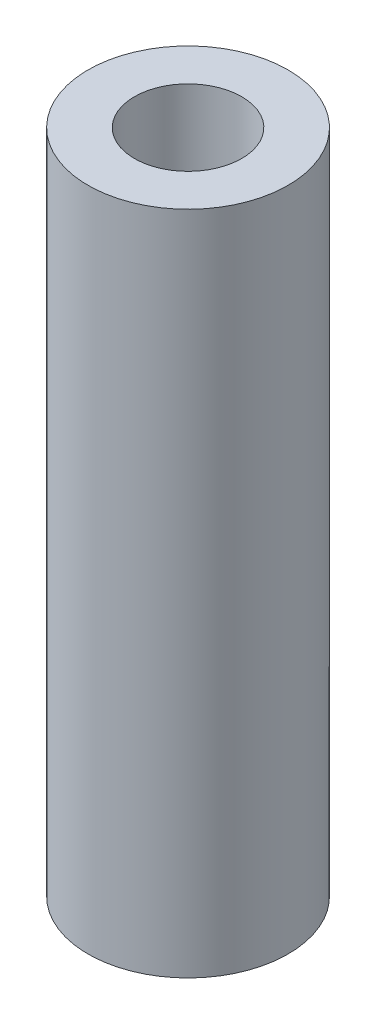
from build123d import *

# Parameters (mm, degrees)
SKETCH1_R           = 4.7625
SKETCH1_R_2         = 2.5527
BOSS_EXTRUDE1_DEPTH = 31.6992


with BuildPart() as part:
    # Sketch1 → Boss-Extrude1 (new body)
    with BuildSketch(Plane(origin=(0, 0, 0), x_dir=(1, 0, 0), z_dir=(0, 1, 0))):
        with Locations(Location((0, 0, 0), (0, 0, 270))):
            Circle(SKETCH1_R)
        with Locations(Location((0, 0, 0), (0, 0, 270))):
            Circle(SKETCH1_R_2, mode=Mode.SUBTRACT)
    extrude(amount=BOSS_EXTRUDE1_DEPTH)


solid = part.part
